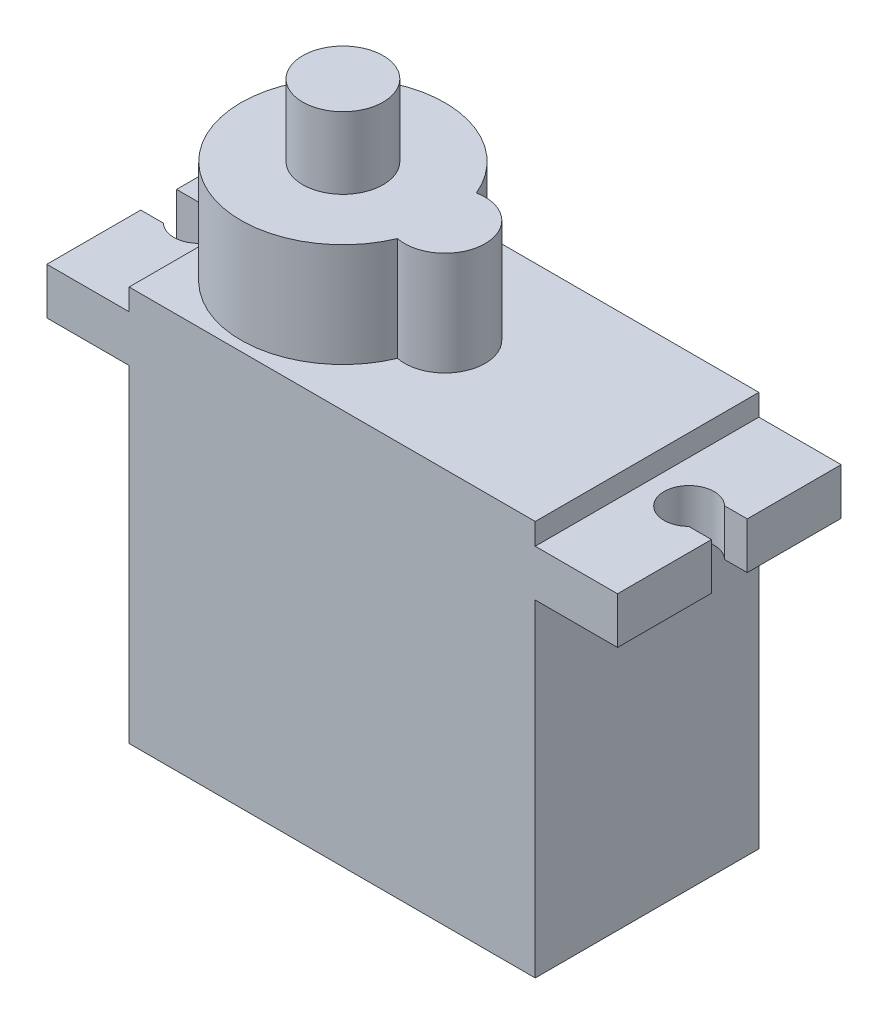
from build123d import *

# Parameters (mm, degrees)
RESSALTO_EXTRUS_O1_DEPTH = 12.5
RESSALTO_EXTRUS_O2_DEPTH = 5.8
CORTE_EXTRUS_O1_DEPTH    = 5.5
ESBO_O4_R                = 2.25
RESSALTO_EXTRUS_O3_DEPTH = 4


with BuildPart() as part:
    # Esboço1 → Ressalto-extrusão1 (new body)
    with BuildSketch(Plane.XY):
        Polygon((11.35, 11.75), (15.95, 11.75), (15.95, 9.15), (11.35, 9.15), (11.35, -9.15), (-11.35, -9.15), (-11.35, 9.15), (-15.95, 9.15), (-15.95, 11.75), (-11.35, 11.75), (-11.35, 12.95), (11.35, 12.95), align=None)
    extrude(amount=RESSALTO_EXTRUS_O1_DEPTH)

    # Esboço2 → Ressalto-extrusão2 (add)
    with BuildSketch(Plane(origin=(0, 12.95, 0), x_dir=(1, 0, 0), z_dir=(0, 1, 0))):
        with BuildLine():
            ThreePointArc((-0.394078947, -4.04425888), (-11.35, -6.25), (-0.394078947, -8.45574112))
            ThreePointArc((-0.394078947, -8.45574112), (2.3, -6.25), (-0.394078947, -4.04425888))
        make_face()
    extrude(amount=RESSALTO_EXTRUS_O2_DEPTH)

    # Esboço3 → Corte-extrusão1 (cut)
    with BuildSketch(Plane(origin=(0, 11.75, 0), x_dir=(1, 0, 0), z_dir=(0, 1, 0))):
        with BuildLine():
            Line((-15.95, -7.25), (-14.679795897, -7.25))
            ThreePointArc((-14.679795897, -7.25), (-12.3, -6.25), (-14.679795897, -5.25))
            Line((-14.679795897, -5.25), (-15.95, -5.25))
            Line((-15.95, -5.25), (-15.95, -7.25))
        make_face()
        with BuildLine():
            Line((15.95, -5.25), (15.95, -7.25))
            Line((15.95, -7.25), (14.679795897, -7.25))
            ThreePointArc((14.679795897, -7.25), (12.3, -6.25), (14.679795897, -5.25))
            Line((14.679795897, -5.25), (15.95, -5.25))
        make_face()
    extrude(amount=-CORTE_EXTRUS_O1_DEPTH, mode=Mode.SUBTRACT)

    # Esboço4 → Ressalto-extrusão3 (add)
    with BuildSketch(Plane(origin=(0, 18.75, 0), x_dir=(1, 0, 0), z_dir=(0, 1, 0))):
        with Locations(Location((-5.65, -6.25, 0), (0, 0, 270))):
            Circle(ESBO_O4_R)
    extrude(amount=RESSALTO_EXTRUS_O3_DEPTH)


solid = part.part
